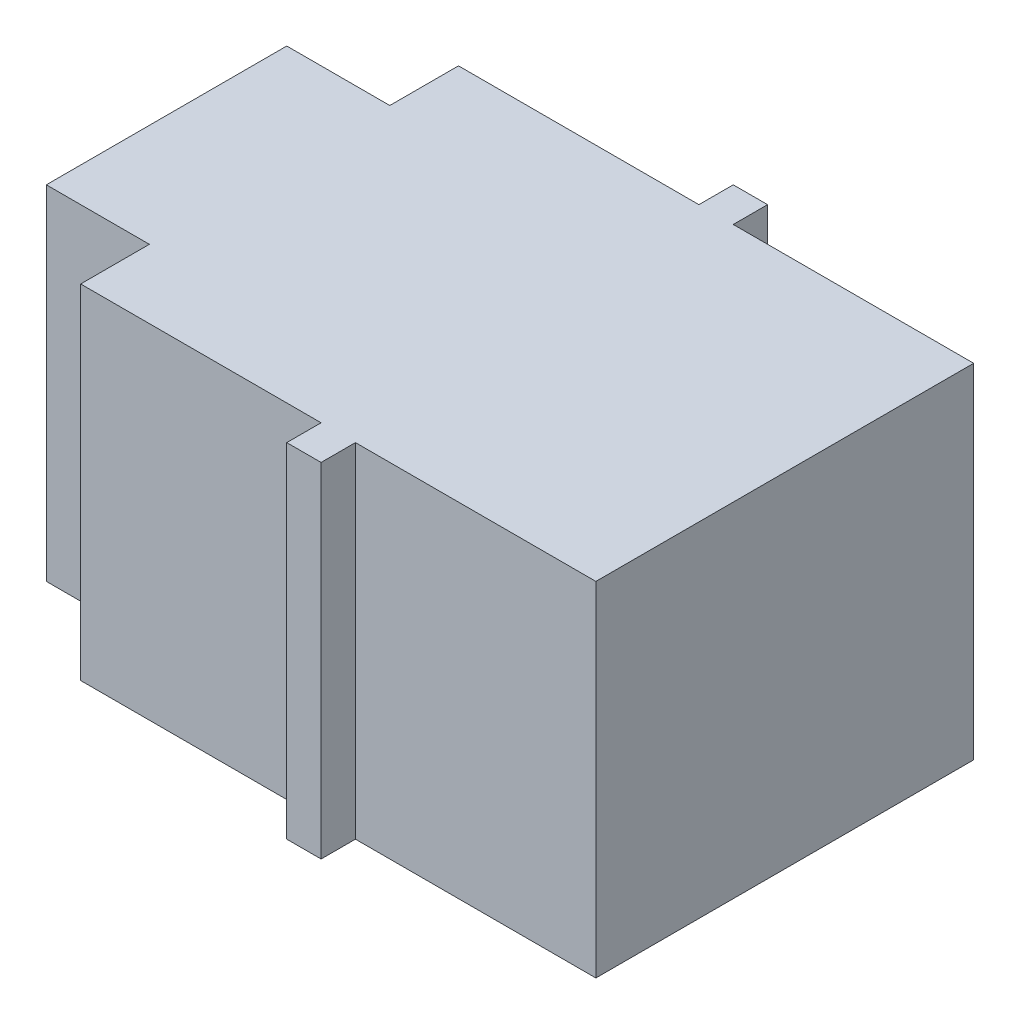
from build123d import *

# Parameters (mm, degrees)
BOSS_EXTRUDE1_DEPTH = 10
SKETCH6_W           = 14.6
SKETCH6_H           = 10.6
SKETCH6_W_2         = 3
SKETCH6_H_2         = 6.6
BOSS_EXTRUDE4_DEPTH = 0.2
SKETCH7_W           = 14.6
SKETCH7_H           = 10.6
SKETCH7_W_2         = 3
SKETCH7_H_2         = 6.6
BOSS_EXTRUDE5_DEPTH = 0.2
CUT_EXTRUDE3_DEPTH  = 0.5


with BuildPart() as part:
    # Sketch1 → Boss-Extrude1 (new body)
    with BuildSketch(Plane(origin=(0, 0, 0), x_dir=(1, 0, 0), z_dir=(0, 1, 0))):
        Polygon((-10.028718685, -3.5), (-10.028718685, 3.5), (-7.028718685, 3.5), (-7.028718685, 5.5), (-0.028718685, 5.5), (-0.028718685, 6.5), (0.971281315, 6.5), (0.971281315, 5.5), (7.971281315, 5.5), (7.971281315, -5.5), (0.971281315, -5.5), (0.971281315, -6.5), (-0.028718685, -6.5), (-0.028718685, -5.5), (-7.028718685, -5.5), (-7.028718685, -3.5), align=None)
        Polygon((-9.828718685, 3.3), (-6.828718685, 3.3), (-6.828718685, 5.3), (0.171281315, 5.3), (0.771281315, 5.3), (7.771281315, 5.3), (7.771281315, -5.3), (0.771281315, -5.3), (0.171281315, -5.3), (-6.828718685, -5.3), (-6.828718685, -3.3), (-9.828718685, -3.3), align=None, mode=Mode.SUBTRACT)
    extrude(amount=BOSS_EXTRUDE1_DEPTH)

    # Sketch6 → Boss-Extrude4 (add)
    with BuildSketch(Plane(origin=(0, 0, 0), x_dir=(-1, 0, 0), z_dir=(0, -1, 0))):
        with Locations((-0.471281315, 0)):
            Rectangle(SKETCH6_W, SKETCH6_H)
        with Locations((8.328718685, 0)):
            Rectangle(SKETCH6_W_2, SKETCH6_H_2)
    extrude(amount=-BOSS_EXTRUDE4_DEPTH)

    # Sketch7 → Boss-Extrude5 (add)
    with BuildSketch(Plane(origin=(0, 10, 0), x_dir=(1, 0, 0), z_dir=(0, 1, 0))):
        with Locations((0.471281315, 0)):
            Rectangle(SKETCH7_W, SKETCH7_H)
        with Locations((-8.328718685, 0)):
            Rectangle(SKETCH7_W_2, SKETCH7_H_2)
    extrude(amount=-BOSS_EXTRUDE5_DEPTH)

    # Sketch8 → Cut-Extrude3 (cut)
    with BuildSketch(Plane.ZY.offset(10.028718685)):
        with BuildLine():
            Line((0, 9.314071319), (0, 5))
            Line((0, 5), (1.25, 5))
            Line((1.25, 5), (1.25, 8.064071319))
            ThreePointArc((1.25, 8.064071319), (0.883883476, 8.947954796), (0, 9.314071319))
        make_face()
        with BuildLine():
            Line((-1.25, 5), (0, 5))
            Line((0, 5), (0, 9.314071319))
            ThreePointArc((0, 9.314071319), (-0.883883476, 8.947954796), (-1.25, 8.064071319))
            Line((-1.25, 8.064071319), (-1.25, 5))
        make_face()
        with BuildLine():
            ThreePointArc((-1.25, 3.135928681), (-0.883883476, 2.252045204), (0, 1.885928681))
            Line((0, 1.885928681), (0, 5))
            Line((0, 5), (-1.25, 5))
            Line((-1.25, 5), (-1.25, 3.135928681))
        make_face()
        with BuildLine():
            Line((0, 5), (0, 1.885928681))
            ThreePointArc((0, 1.885928681), (0.883883476, 2.252045204), (1.25, 3.135928681))
            Line((1.25, 3.135928681), (1.25, 5))
            Line((1.25, 5), (0, 5))
        make_face()
    extrude(amount=-CUT_EXTRUDE3_DEPTH, mode=Mode.SUBTRACT)


solid = part.part
